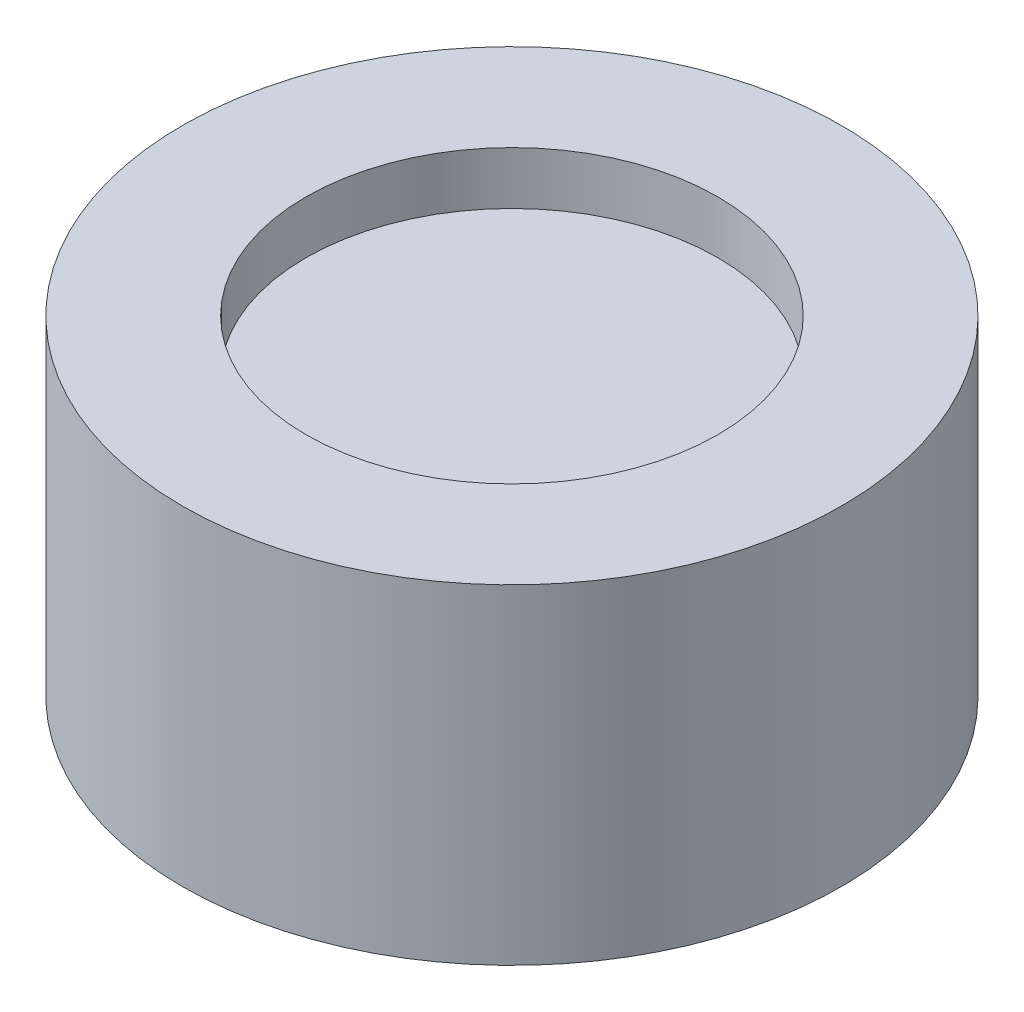
from build123d import *

# Parameters (mm, degrees)
SKETCH1_R                 = 6.35
BOSS_EXTRUDE1_DEPTH       = 6.35
SKETCH2_R                 = 3.96875
CUT_EXTRUDE1_DEPTH        = 1.016
F_4_40_TAPPED_HOLE1_D     = 2.2606
F_4_40_TAPPED_HOLE1_DEPTH = 2.032
F_4_40_TAPPED_HOLE1_TIP   = 0.679152758


with BuildPart() as part:
    # Sketch1 → Boss-Extrude1 (new body)
    with BuildSketch(Plane(origin=(0, 0, 0), x_dir=(1, 0, 0), z_dir=(0, 1, 0))):
        with Locations(Location((0, 0, 0), (0, 0, 270))):
            Circle(SKETCH1_R)
    extrude(amount=BOSS_EXTRUDE1_DEPTH)

    # Sketch2 → Cut-Extrude1 (cut)
    with BuildSketch(Plane(origin=(0, 6.35, 0), x_dir=(1, 0, 0), z_dir=(0, 1, 0))):
        with Locations(Location((0, 0, 0), (0, 0, 270))):
            Circle(SKETCH2_R)
    extrude(amount=-CUT_EXTRUDE1_DEPTH, mode=Mode.SUBTRACT)

    # #4-40 Tapped Hole1
    with Locations(Plane(origin=(0, 0, 0), x_dir=(-1, 0, 0), z_dir=(0, -1, 0))):
        with Locations((0, 0)):
            Hole(F_4_40_TAPPED_HOLE1_D / 2, depth=F_4_40_TAPPED_HOLE1_DEPTH)
            with Locations((0, 0, -(F_4_40_TAPPED_HOLE1_DEPTH + F_4_40_TAPPED_HOLE1_TIP / 2))):  # 118° drill point
                Cone(0, F_4_40_TAPPED_HOLE1_D / 2, F_4_40_TAPPED_HOLE1_TIP, mode=Mode.SUBTRACT)


solid = part.part
